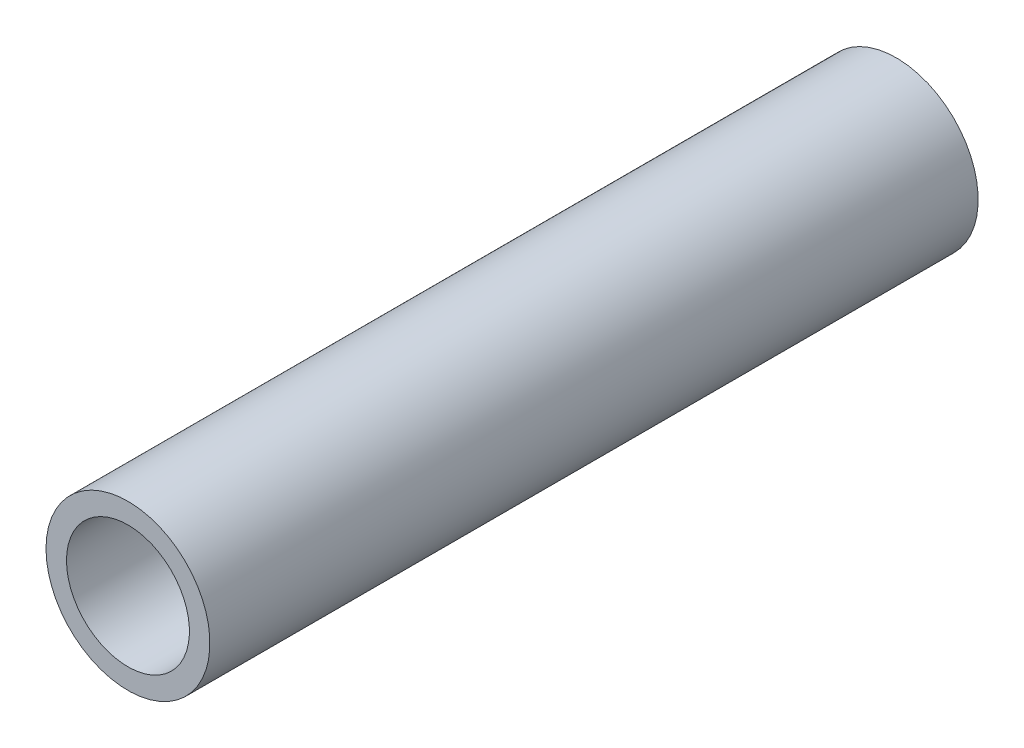
from build123d import *

# Parameters (mm, degrees)
TUBE_PROFILE_R   = 4
TUBE_PROFILE_R_2 = 3


with BuildPart() as part:
    # Tube: sweep along a curve in space
    with BuildLine() as tube_path:
        Line((180, 21, 27), (180, 21, -10.5))
    # Tube profile (on start of the path) → Tube (sweep)
    with BuildSketch(Plane(origin=(180, 21, 27), x_dir=(-1, 0, 0), z_dir=(0, 0, -1))):
        Circle(TUBE_PROFILE_R)
        Circle(TUBE_PROFILE_R_2, mode=Mode.SUBTRACT)
    sweep(path=tube_path.line)


solid = part.part
